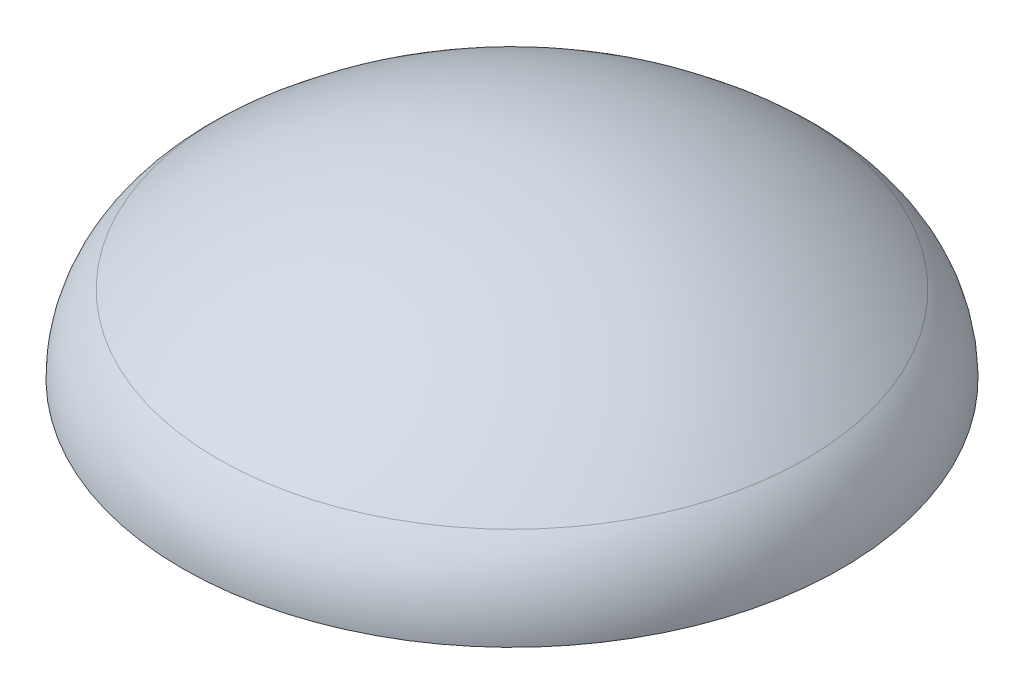
from build123d import *


with BuildPart() as part:
    # Эскиз1 → Повернуть1 (revolve)
    with BuildSketch(Plane.XY, mode=Mode.PRIVATE) as revolve_1_sk:
        with BuildLine():
            Line((0, 39.365015509), (0, 36.365015509))
            ThreePointArc((0, 36.365015509), (32.17757493, 30.613071104), (60.369714413, 14.069659602))
            ThreePointArc((60.369714413, 14.069659602), (65.152068541, 7.74515046), (66.85, 0))
            Line((66.85, 0), (69.85, 0))
            ThreePointArc((69.85, 0), (67.87693354, 9.000184617), (62.319640589, 16.349525367))
            ThreePointArc((62.319640589, 16.349525367), (33.216902285, 33.427284786), (0, 39.365015509))
        make_face()
    revolve(revolve_1_sk.sketch.rotate(Axis((0, 69.552045475, 0), (0, -1, 0)), 90), axis=Axis((0, 69.552045475, 0), (0, -1, 0)))


solid = part.part
